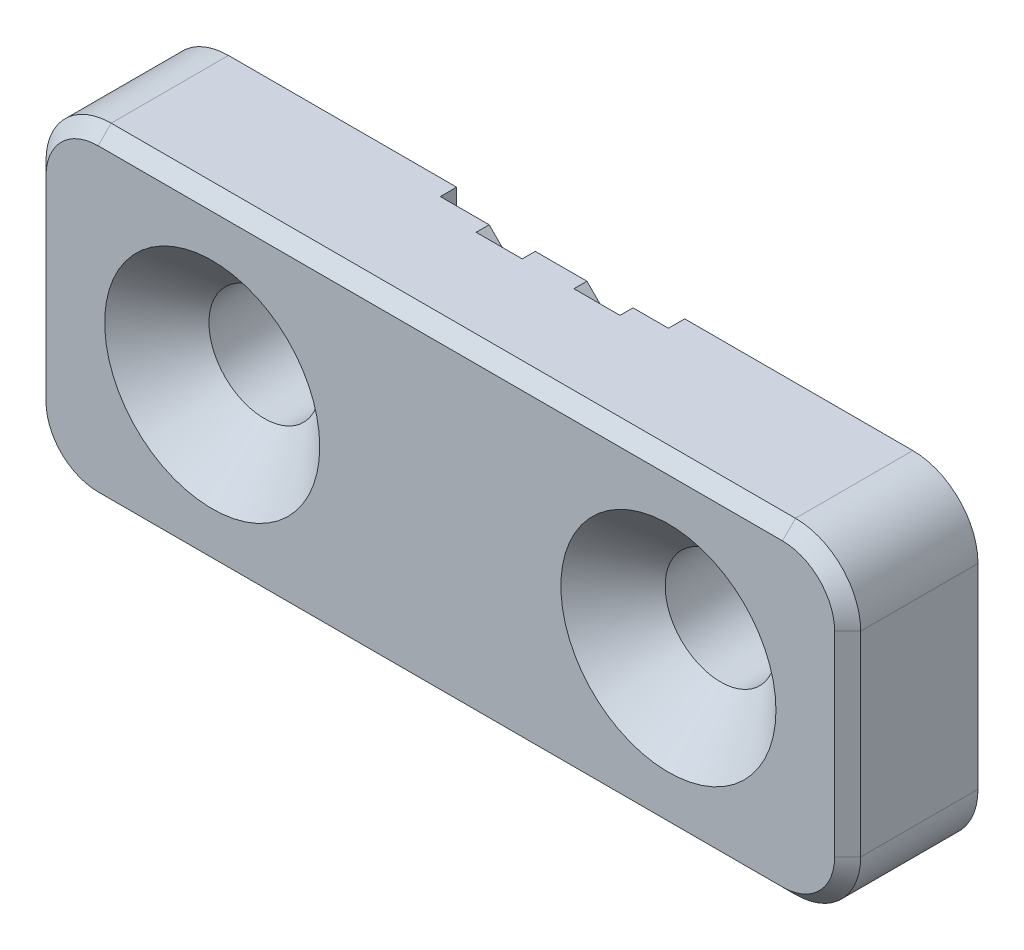
from build123d import *

# Parameters (mm, degrees)
SKETCH_1_W                   = 25
SKETCH_1_H                   = 10
EXTRUDE_1_DEPTH              = 4
SKETCH_2_W                   = 7
SKETCH_2_H                   = 1
CUT_EXTRUDE_1_DEPTH          = 17.5
HOLE_WIZARD_M3_1_D           = 3.4
HOLE_WIZARD_M3_1_CSINK_D     = 6.6
HOLE_WIZARD_M3_1_CSINK_ANGLE = 90
FILLET_1_R                   = 2
CHAMFER_1_SIZE               = 0.4
CUT_EXTRUDE_2_DEPTH          = 0.4


with BuildPart() as part:
    # 草图1 → 凸台-拉伸1 (new body)
    with BuildSketch(Plane.XY):
        Rectangle(SKETCH_1_W, SKETCH_1_H)
    extrude(amount=EXTRUDE_1_DEPTH)

    # 草图2 → 切除-拉伸1 (cut, through all)
    with BuildSketch(Plane(origin=(0, 5, 0), x_dir=(1, 0, 0), z_dir=(0, 1, 0))):
        Rectangle(SKETCH_2_W, SKETCH_2_H)
    extrude(amount=-CUT_EXTRUDE_1_DEPTH, mode=Mode.SUBTRACT)

    # M3 十字槽沉头木螺钉的锥形沉头孔1 (through all)
    with Locations(Plane.XY.offset(4)):
        with Locations((7, 0)):
            hole_wizard_m3_1 = CounterSinkHole(HOLE_WIZARD_M3_1_D / 2, HOLE_WIZARD_M3_1_CSINK_D / 2, counter_sink_angle=HOLE_WIZARD_M3_1_CSINK_ANGLE)

    # 镜向1: M3 十字槽沉头木螺钉的锥形沉头孔1 across plane
    add(hole_wizard_m3_1.mirror(Plane(origin=(0, 0, 0), x_dir=(0, 0, 1), z_dir=(1, 0, 0))), mode=Mode.SUBTRACT)

    # 圆角1
    fillet_1_edges = [part.edges().sort_by_distance(p)[0] for p in [
        (12.5, -5, 2),
        (-12.5, -5, 2),
        (-12.5, 5, 2),
        (12.5, 5, 2),
    ]]
    fillet(fillet_1_edges, radius=FILLET_1_R)

    # 倒角1
    chamfer_1_edges = [part.edges().sort_by_distance(p)[0] for p in [
        (-12.5, 0, 4),
        (0, 5, 4),
        (12.5, 0, 4),
        (0, -5, 4),
        (11.914213562, 4.414213562, 4),
        (11.914213562, -4.414213562, 4),
        (-11.914213562, -4.414213562, 4),
        (-11.914213562, 4.414213562, 4),
    ]]
    chamfer(chamfer_1_edges, length=CHAMFER_1_SIZE)

    # 草图5 → 切除-拉伸2 (cut)
    with BuildSketch(Plane(origin=(0, 0, 0.5), x_dir=(-1, 0, 0), z_dir=(0, 0, -1))):
        Polygon((-3.5, -2.085786438), (-3.5, -3.5), (3.5, 3.5), (3.5, 4.914213562), align=None)
        Polygon((3.5, 0.5), (3.5, 1.914213562), (-3.414213562, -5), (-2, -5), align=None)
        Polygon((-3.5, 0.914213562), (-3.5, -0.5), (2, 5), (0.585786438, 5), align=None)
        Polygon((3.5, -2.5), (3.5, -1.085786438), (-0.414213562, -5), (1, -5), align=None)
        Polygon((-3.5, 3.914213562), (-3.5, 2.5), (-1, 5), (-2.414213562, 5), align=None)
        Polygon((3.5, -5), (3.5, -4.085786438), (2.585786438, -5), align=None)
    extrude(amount=-CUT_EXTRUDE_2_DEPTH, mode=Mode.SUBTRACT)


solid = part.part
